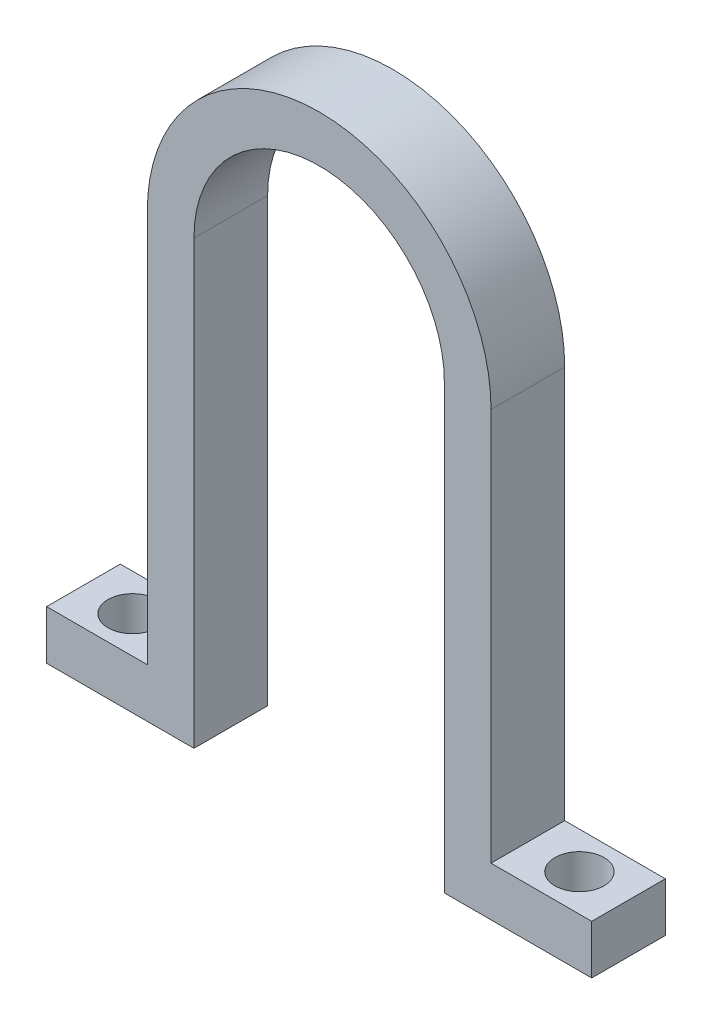
from build123d import *

# Parameters (mm, degrees)
BOSS_EXTRUDE1_DEPTH = 15
SKETCH3_R           = 5
CUT_EXTRUDE2_DEPTH  = 138.587245048


with BuildPart() as part:
    # Sketch1 → Boss-Extrude1 (new body)
    with BuildSketch(Plane.XY):
        with BuildLine():
            Line((55.5, -90), (55.5, -80))
            Line((55.5, -80), (35, -80))
            Line((35, -80), (35, 0))
            ThreePointArc((35, 0), (0, 35), (-35, 0))
            Line((-35, 0), (-35, -80))
            Line((-35, -80), (-55.5, -80))
            Line((-55.5, -80), (-55.5, -90))
            Line((-55.5, -90), (-25.5, -90))
            Line((-25.5, -90), (-25.5, 0))
            ThreePointArc((-25.5, 0), (0, 25.5), (25.5, 0))
            Line((25.5, 0), (25.5, -90))
            Line((25.5, -90), (55.5, -90))
        make_face()
    extrude(amount=BOSS_EXTRUDE1_DEPTH)

    # Sketch3 → Cut-Extrude2 (cut, through all)
    with BuildSketch(Plane.XZ.offset(90)):
        with Locations(Location((-45.5, 7.5, 0), (0, 0, 270))):
            Circle(SKETCH3_R)
        with Locations(Location((45.5, 7.5, 0), (0, 0, 270))):
            Circle(SKETCH3_R)
    extrude(amount=-CUT_EXTRUDE2_DEPTH, mode=Mode.SUBTRACT)


solid = part.part
